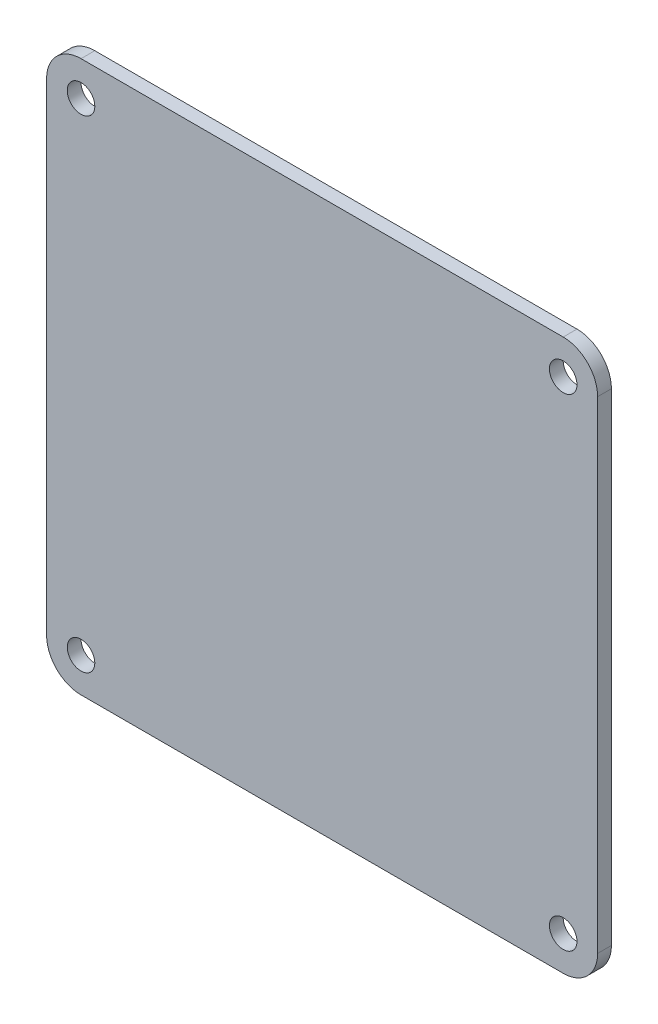
from build123d import *

# Parameters (mm, degrees)
SKETCH1_W           = 80
SKETCH1_H           = 80
BOSS_EXTRUDE1_DEPTH = 2
SKETCH2_R           = 3.5
BOSS_EXTRUDE2_DEPTH = 1
SKETCH3_R           = 2
CUT_EXTRUDE1_DEPTH  = 1
FILLET1_R           = 5
SKETCH4_R           = 2
CUT_EXTRUDE2_DEPTH  = 11
SKETCH5_W           = 60
SKETCH5_H           = 60
CUT_EXTRUDE4_DEPTH  = 1


with BuildPart() as part:
    # Sketch1 → Boss-Extrude1 (new body)
    with BuildSketch(Plane.XY):
        Rectangle(SKETCH1_W, SKETCH1_H)
    extrude(amount=BOSS_EXTRUDE1_DEPTH)

    # Sketch2 → Boss-Extrude2 (add)
    with BuildSketch(Plane(origin=(0, 0, 0), x_dir=(-1, 0, 0), z_dir=(0, 0, -1))):
        with Locations(Location((0, 24.55, 0), (0, 0, 116.872206362))):
            Circle(SKETCH2_R)
        with Locations(Location((24.55, 0, 0), (0, 0, 26.872206362))):
            Circle(SKETCH2_R)
        with Locations(Location((0, -24.55, 0), (0, 0, 243.127793638))):
            Circle(SKETCH2_R)
        with Locations(Location((-24.55, 0, 0), (0, 0, 153.127793638))):
            Circle(SKETCH2_R)
    extrude(amount=BOSS_EXTRUDE2_DEPTH)

    # Sketch3 → Cut-Extrude1 (cut)
    with BuildSketch(Plane(origin=(0, 0, -1), x_dir=(-1, 0, 0), z_dir=(0, 0, -1))):
        with Locations((-24.55, 0)):
            Circle(SKETCH3_R)
        with Locations((0, 24.55)):
            Circle(SKETCH3_R)
        with Locations((0, -24.55)):
            Circle(SKETCH3_R)
        with Locations((24.55, 0)):
            Circle(SKETCH3_R)
    extrude(amount=-CUT_EXTRUDE1_DEPTH, mode=Mode.SUBTRACT)

    # Fillet1
    fillet1_edges = [part.edges().sort_by_distance(p)[0] for p in [
        (-40, 40, 1),
        (40, 40, 1),
        (-40, -40, 1),
        (40, -40, 1),
    ]]
    fillet(fillet1_edges, radius=FILLET1_R)

    # Sketch4 → Cut-Extrude2 (cut)
    with BuildSketch(Plane.XY.offset(2)):
        with Locations((35, 35)):
            Circle(SKETCH4_R)
        with Locations((-35, 35)):
            Circle(SKETCH4_R)
        with Locations((35, -35)):
            Circle(SKETCH4_R)
        with Locations((-35, -35)):
            Circle(SKETCH4_R)
    extrude(amount=-CUT_EXTRUDE2_DEPTH, mode=Mode.SUBTRACT)

    # Sketch5 → Cut-Extrude4 (cut)
    with BuildSketch(Plane(origin=(0, 0, 0), x_dir=(-1, 0, 0), z_dir=(0, 0, -1))):
        Rectangle(SKETCH5_W, SKETCH5_H)
        with BuildLine():
            Line((26.464466094, -3.535533906), (3.535533906, -26.464466094))
            ThreePointArc((3.535533906, -26.464466094), (0, -27.928932188), (-3.535533906, -26.464466094))
            Line((-3.535533906, -26.464466094), (-26.464466094, -3.535533906))
            ThreePointArc((-26.464466094, -3.535533906), (-27.928932188, 0), (-26.464466094, 3.535533906))
            Line((-26.464466094, 3.535533906), (-3.535533906, 26.464466094))
            ThreePointArc((-3.535533906, 26.464466094), (0, 27.928932188), (3.535533906, 26.464466094))
            Line((3.535533906, 26.464466094), (26.464466094, 3.535533906))
            ThreePointArc((26.464466094, 3.535533906), (27.928932188, 0), (26.464466094, -3.535533906))
        make_face(mode=Mode.SUBTRACT)
    extrude(amount=-CUT_EXTRUDE4_DEPTH, mode=Mode.SUBTRACT)


solid = part.part
